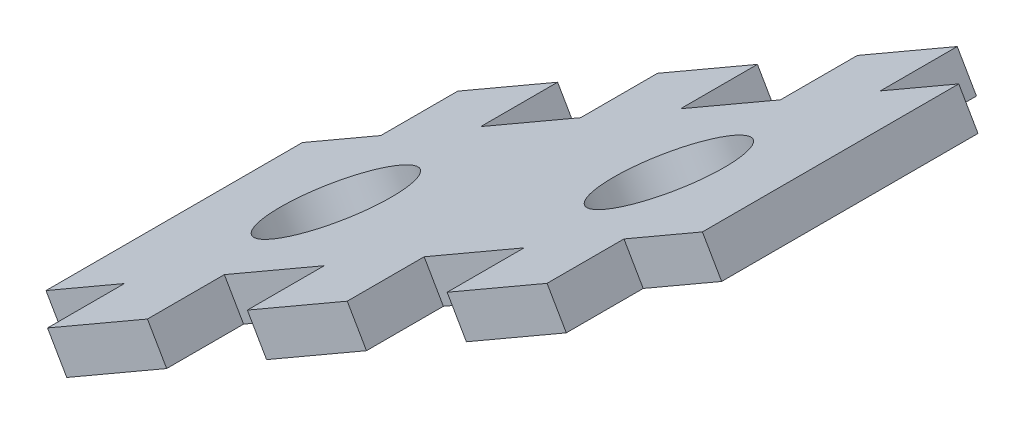
from build123d import *

# Parameters (mm, degrees)
BOSS_EXTRU_1_DEPTH      = 40
BOSS_EXTRU_2_DEPTH      = 12
BOSS_EXTRU_2_DEPTH_BACK = 52
ESQUISSE2_R             = 10
ENL_V_MAT_EXTRU_2_DEPTH = 12


with BuildPart() as part:
    # Esquisse1 → Boss.-Extru.1 (new body)
    with BuildSketch(Plane.XY):
        Polygon((-82.421937441, -243.855765017), (20, -184.722431864), (23, -189.918584287), (-79.421937441, -249.05191744), align=None)
    extrude(amount=BOSS_EXTRU_1_DEPTH)

    # Esquisse3 → Boss.-Extru.2 (add, two sides: drawn at the far end of the back side and taken through both)
    with BuildSketch(Plane(origin=(0, 0, 0), x_dir=(-1, 0, 0), z_dir=(0, 0, -1)).offset(-BOSS_EXTRU_2_DEPTH_BACK)):
        Polygon((4.828282819, -205.985250863), (7.828282819, -200.789098441), (-7.76017445, -191.789098441), (-10.76017445, -196.985250863), align=None)
        Polygon((39.005197355, -218.789098441), (31.210968721, -214.289098441), (28.210968721, -219.485250863), (36.005197355, -223.985250863), align=None)
        Polygon((28.210968721, -219.485250863), (31.210968721, -214.289098441), (23.416740087, -209.789098441), (20.416740087, -214.985250863), align=None)
        Polygon((70.182111891, -236.789098441), (54.593654623, -227.789098441), (51.593654623, -232.985250863), (67.182111891, -241.985250863), align=None)
    extrude(amount=BOSS_EXTRU_2_DEPTH + BOSS_EXTRU_2_DEPTH_BACK)

    # Esquisse2 → Enlèv. mat.-Extru.2 (cut)
    with BuildSketch(Plane(origin=(84.987159322, -147.202077936, 0), x_dir=(0.8660254037844385, 0.5000000000000003, 0), z_dir=(-0.5000000000000003, 0.8660254037844385, 0))):
        with Locations(Location((-164.174041009, -20, 0), (0, 0, 180))):
            Circle(ESQUISSE2_R)
        with Locations(Location((-104.174041009, -20, 0), (0, 0, 180))):
            Circle(ESQUISSE2_R)
    extrude(amount=-ENL_V_MAT_EXTRU_2_DEPTH, mode=Mode.SUBTRACT)


solid = part.part
